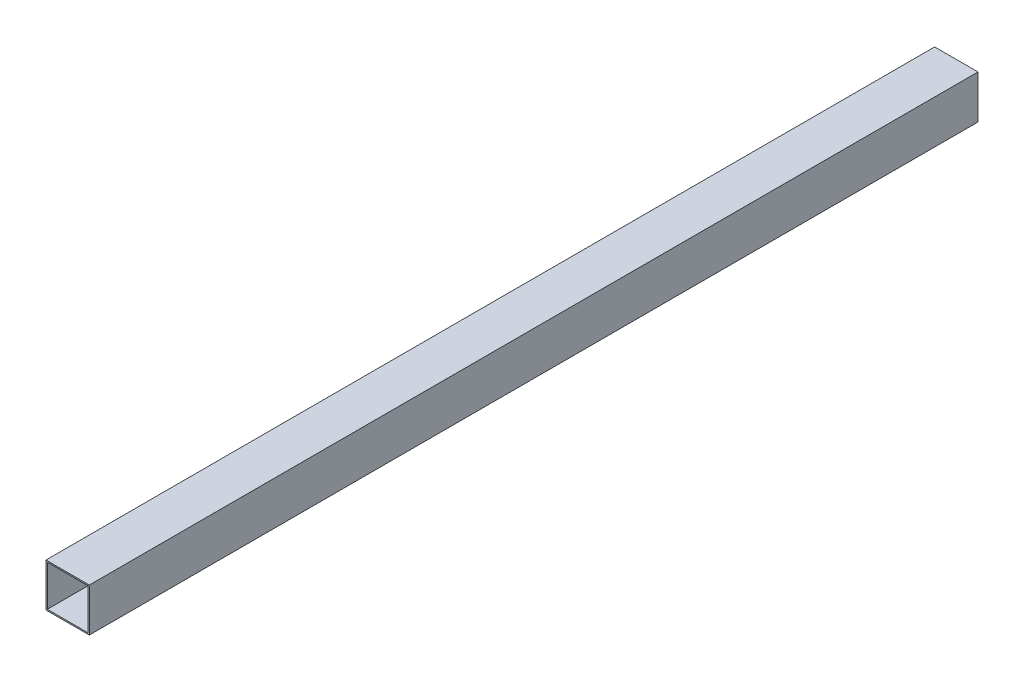
from build123d import *

# Parameters (mm, degrees)
SKETCH1_W           = 40
SKETCH1_H           = 40
SKETCH1_W_2         = 37.6
SKETCH1_H_2         = 37.6
BOSS_EXTRUDE1_DEPTH = 820


with BuildPart() as part:
    # Sketch1 → Boss-Extrude1 (new body)
    with BuildSketch(Plane.XY):
        Rectangle(SKETCH1_W, SKETCH1_H)
        Rectangle(SKETCH1_W_2, SKETCH1_H_2, mode=Mode.SUBTRACT)
    extrude(amount=BOSS_EXTRUDE1_DEPTH)


solid = part.part
